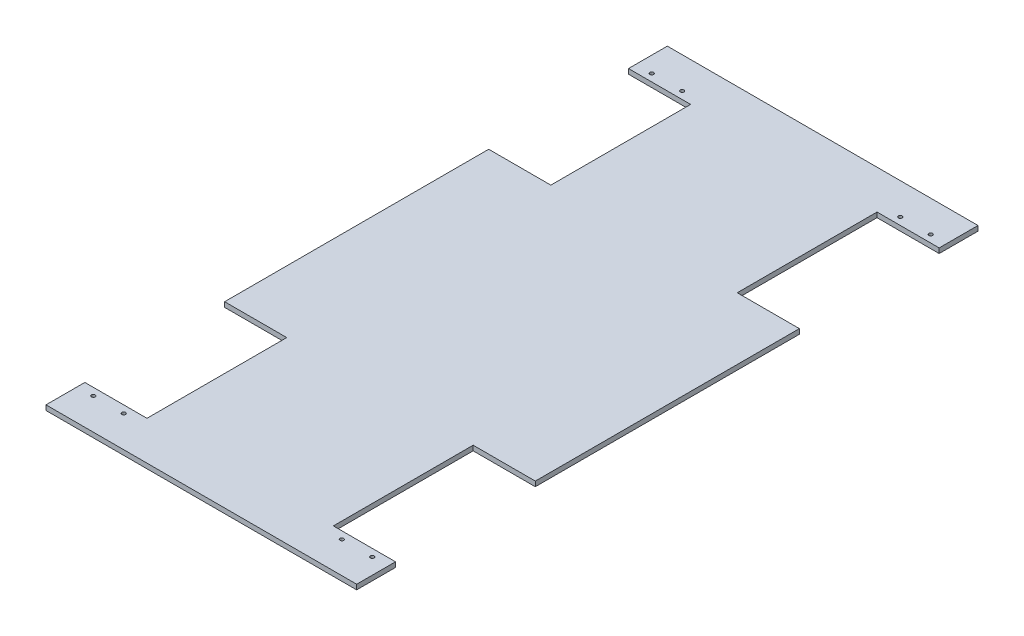
from build123d import *

# Parameters (mm, degrees)
BOSS_EXTRUDE1_DEPTH                  = 3.175
F_3_32_0_09375_DIAMETER_HOLE1_D      = 2.38125
MIRROR5_AT_THE_SECOND_PLANE_COPY_1_D = 2.38125


with BuildPart() as part:
    # Sketch1 → Boss-Extrude1 (new body)
    with BuildSketch(Plane(origin=(0, 0, 0), x_dir=(1, 0, 0), z_dir=(0, 1, 0))):
        Polygon((-100, 85), (-100, -85), (-60, -85), (-60, -175), (-100, -175), (-100, -200), (100, -200), (100, -175), (60, -175), (60, -85), (100, -85), (100, 85), (60, 85), (60, 175), (100, 175), (100, 200), (-100, 200), (-100, 175), (-60, 175), (-60, 85), align=None)
    extrude(amount=BOSS_EXTRUDE1_DEPTH)

    # 3/32 (0.09375) Diameter Hole1 (through all)
    with Locations(Plane(origin=(0, 3.175, 0), x_dir=(1, 0, 0), z_dir=(0, 1, 0))):
        with Locations((-89.78, 179.7625), (-70.22, 179.7625)):
            f_3_32_0_09375_diameter_hole1 = Hole(F_3_32_0_09375_DIAMETER_HOLE1_D / 2)

    # Mirror5: 3/32 (0.09375) Diameter Hole1 across plane
    add(f_3_32_0_09375_diameter_hole1.mirror(Plane(origin=(0, 0, 0), x_dir=(0, 0, 1), z_dir=(1, 0, 0))), mode=Mode.SUBTRACT)

    # Mirror5 at the second plane: 3/32 (0.09375) Diameter Hole1 across plane
    add(f_3_32_0_09375_diameter_hole1.mirror(Plane.XY), mode=Mode.SUBTRACT)

    # Mirror5 at the second plane copy 1 (through all)
    with Locations(Plane(origin=(0, 3.175, 0), x_dir=(-1, 0, 0), z_dir=(0, 1, 0))):
        with Locations((-89.78, 179.7625), (-70.22, 179.7625)):
            Hole(MIRROR5_AT_THE_SECOND_PLANE_COPY_1_D / 2)


solid = part.part
